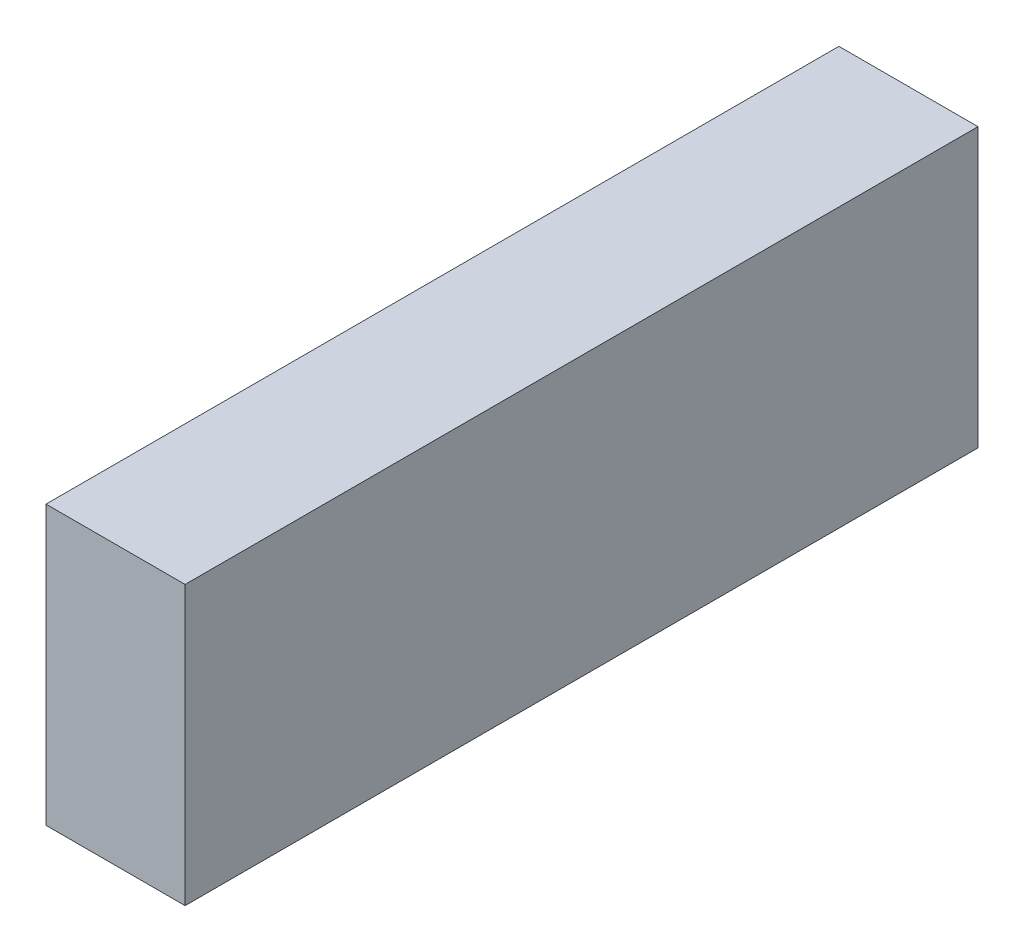
from build123d import *

# Parameters (mm, degrees)
SKETCH1_W           = 57
SKETCH1_H           = 20
BOSS_EXTRUDE1_DEPTH = 10


with BuildPart() as part:
    # Sketch1 → Boss-Extrude1 (new body)
    with BuildSketch(Plane(origin=(0, 0, 0), x_dir=(0, 0, -1), z_dir=(1, 0, 0))):
        with Locations((28.5, 10)):
            Rectangle(SKETCH1_W, SKETCH1_H)
    extrude(amount=-BOSS_EXTRUDE1_DEPTH)


solid = part.part
